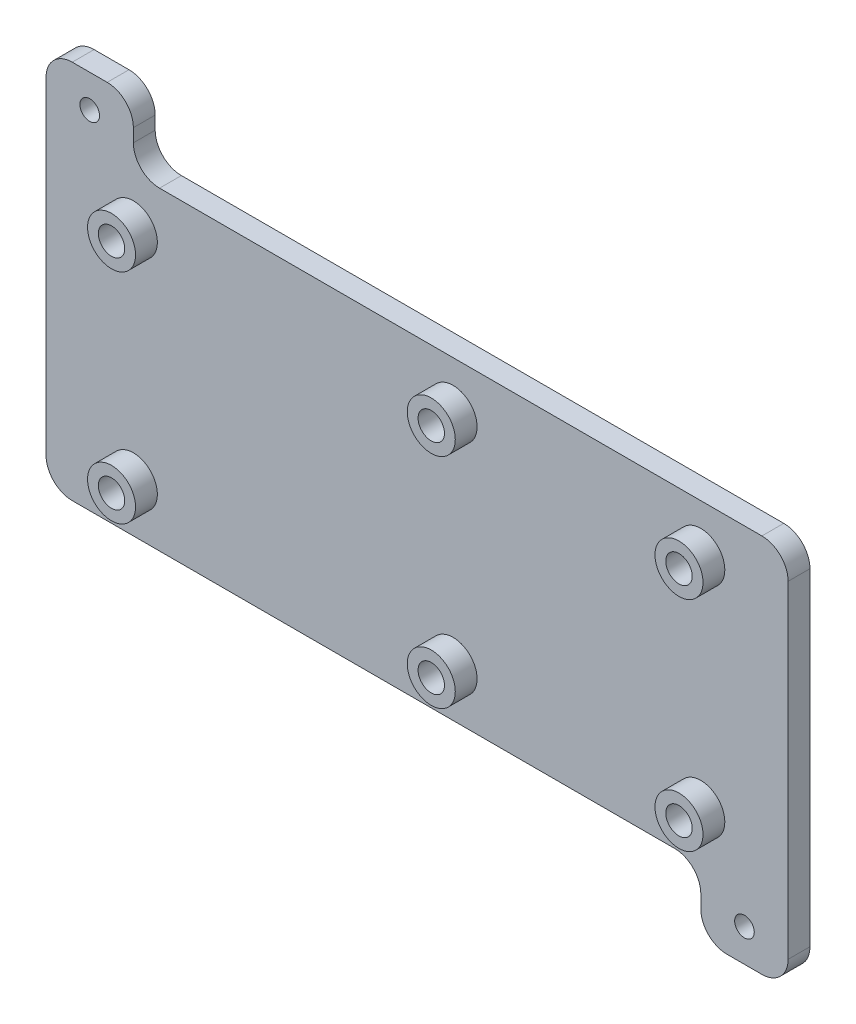
from build123d import *

# Parameters (mm, degrees)
SKETCH1_W            = 170
SKETCH1_H            = 72
BOSS_EXTRUDE1_DEPTH  = 5
SKETCH2_R            = 5.5
SKETCH2_R_2          = 3.025
BOSS_EXTRUDE2_DEPTH  = 5
BOSS_EXTRUDE3_DEPTH  = 5
FILLET1_R            = 6
M4_CLEARANCE_HOLE1_D = 4.5


with BuildPart() as part:
    # Sketch1 → Boss-Extrude1 (new body)
    with BuildSketch(Plane.XY):
        Rectangle(SKETCH1_W, SKETCH1_H)
    extrude(amount=BOSS_EXTRUDE1_DEPTH)

    # Sketch2 → Boss-Extrude2 (add)
    # profile 1 of 6: a face of its own
    with BuildSketch(Plane.XY.offset(5)):
        with Locations((65, 25)):
            Circle(SKETCH2_R)
        with Locations((65, 25)):
            Circle(SKETCH2_R_2, mode=Mode.SUBTRACT)
    # profile 2 of 6: a face of its own
    with BuildSketch(Plane.XY.offset(5)):
        with Locations((8.25, 25)):
            Circle(SKETCH2_R)
        with Locations((8.25, 25)):
            Circle(SKETCH2_R_2, mode=Mode.SUBTRACT)
    # profile 3 of 6: a face of its own
    with BuildSketch(Plane.XY.offset(5)):
        with Locations((-65, 25)):
            Circle(SKETCH2_R)
        with Locations((-65, 25)):
            Circle(SKETCH2_R_2, mode=Mode.SUBTRACT)
    # profile 4 of 6: a face of its own
    with BuildSketch(Plane.XY.offset(5)):
        with Locations((-65, -25)):
            Circle(SKETCH2_R)
        with Locations((-65, -25)):
            Circle(SKETCH2_R_2, mode=Mode.SUBTRACT)
    # profile 5 of 6: a face of its own
    with BuildSketch(Plane.XY.offset(5)):
        with Locations((8.25, -25)):
            Circle(SKETCH2_R)
        with Locations((8.25, -25)):
            Circle(SKETCH2_R_2, mode=Mode.SUBTRACT)
    # profile 6 of 6: a face of its own
    with BuildSketch(Plane.XY.offset(5)):
        with Locations((65, -25)):
            Circle(SKETCH2_R)
        with Locations((65, -25)):
            Circle(SKETCH2_R_2, mode=Mode.SUBTRACT)
    extrude(amount=BOSS_EXTRUDE2_DEPTH)

    # Sketch3 → Boss-Extrude3 (add)
    with BuildSketch(Plane.XY.offset(5)):
        Polygon((-65, 51), (-85, 36), (-85, 51), align=None)
        Polygon((-65, 51), (-85, 36), (-65, 36), align=None)
        Polygon((65, -51), (85, -36), (65, -36), align=None)
        Polygon((85, -36), (85, -51), (65, -51), align=None)
    extrude(amount=-BOSS_EXTRUDE3_DEPTH)

    # Fillet1
    fillet1_edges = [part.edges().sort_by_distance(p)[0] for p in [
        (-85, 51, 2.5),
        (-65, 51, 2.5),
        (-65, 36, 2.5),
        (65, -51, 2.5),
        (65, -36, 2.5),
        (85, -51, 2.5),
        (-85, -36, 2.5),
        (85, 36, 2.5),
    ]]
    fillet(fillet1_edges, radius=FILLET1_R)

    # M4 Clearance Hole1 (through all)
    with Locations(Plane.XY.offset(5)):
        with Locations((-75, 43.5), (75, -43.5)):
            Hole(M4_CLEARANCE_HOLE1_D / 2)


solid = part.part
